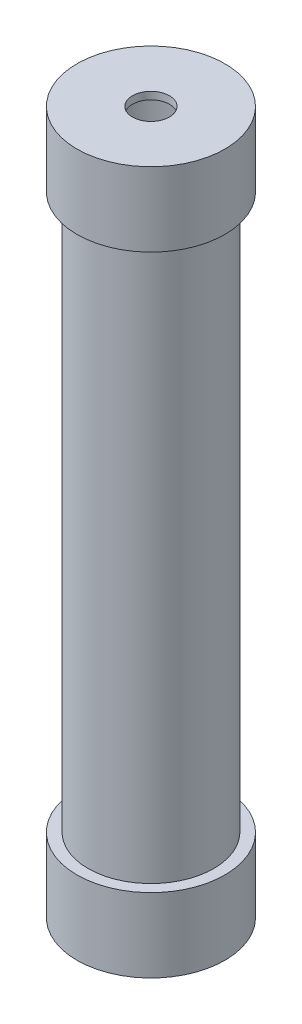
from build123d import *
from build123d.topology import SkipClean

# Parameters (mm, degrees)
EXTRUDE_1_DEPTH = 20
EXTRUDE_START   = -2
EXTRUDE_2_DEPTH = 2
EXTRUDE_START_2 = -150
EXTRUDE_3_DEPTH = 150
EXTRUDE_START_3 = 20
EXTRUDE_4_DEPTH = 20


with BuildPart() as part:
    # 草图1 → 凸台-拉伸1 (new body)
    with BuildSketch(Plane(origin=(0, 0, 0), x_dir=(1, 0, 0), z_dir=(0, 1, 0))):
        with BuildLine():
            Line((0, 20), (0, 15))
            ThreePointArc((0, 15), (15, 0), (0, -15))
            Line((0, -15), (0, -20))
            ThreePointArc((0, -20), (20, 0), (0, 20))
        make_face()
    extrude_1 = extrude(amount=EXTRUDE_1_DEPTH)

    # 草图2 → 凸台-拉伸2 (add)
    with BuildSketch(Plane(origin=(0, 20, 0), x_dir=(1, 0, 0), z_dir=(0, 1, 0)).offset(EXTRUDE_START)):
        with BuildLine():
            Line((0, 20), (0, 5))
            ThreePointArc((0, 5), (5, 0), (0, -5))
            Line((0, -5), (0, -20))
            ThreePointArc((0, -20), (20, 0), (0, 20))
        make_face()
    extrude_2 = extrude(amount=EXTRUDE_2_DEPTH)

    # 草图3 → 凸台-拉伸3 (add)
    with BuildSketch(Plane(origin=(0, 0, 0), x_dir=(1, 0, 0), z_dir=(0, 1, 0)).offset(EXTRUDE_START_2)):
        with BuildLine():
            Line((0, 17), (0, 15))
            ThreePointArc((0, 15), (15, 0), (0, -15))
            Line((0, -15), (0, -17))
            ThreePointArc((0, -17), (17, 0), (0, 17))
        make_face()
    extrude_3 = extrude(amount=EXTRUDE_3_DEPTH)

    # 草图4 → 凸台-拉伸4 (add)
    with BuildSketch(Plane.XZ.offset(150).offset(EXTRUDE_START_3)):
        with BuildLine():
            Line((0, 20), (0, 15))
            ThreePointArc((0, 15), (15, 0), (0, -15))
            Line((0, -15), (0, -20))
            ThreePointArc((0, -20), (20, 0), (0, 20))
        make_face()
    extrude_4 = extrude(amount=-EXTRUDE_4_DEPTH)


with BuildPart() as mirror_1_1:
    # 镜向1: 凸台-拉伸1, 凸台-拉伸2, 凸台-拉伸3, 凸台-拉伸4 across Right Plane
    add(extrude_1.mirror(Plane(origin=(0, 0, 0), x_dir=(0, 0, -1), z_dir=(1, 0, 0))))
    add(extrude_2.mirror(Plane(origin=(0, 0, 0), x_dir=(0, 0, -1), z_dir=(1, 0, 0))))
    add(extrude_3.mirror(Plane(origin=(0, 0, 0), x_dir=(0, 0, -1), z_dir=(1, 0, 0))))
    add(extrude_4.mirror(Plane(origin=(0, 0, 0), x_dir=(0, 0, -1), z_dir=(1, 0, 0))))


with BuildPart() as part_1:
    add(part.part)

    # 镜向1 united with what the copies tou: union 镜向1_1
    add(mirror_1_1.part)


solid = part_1.part
